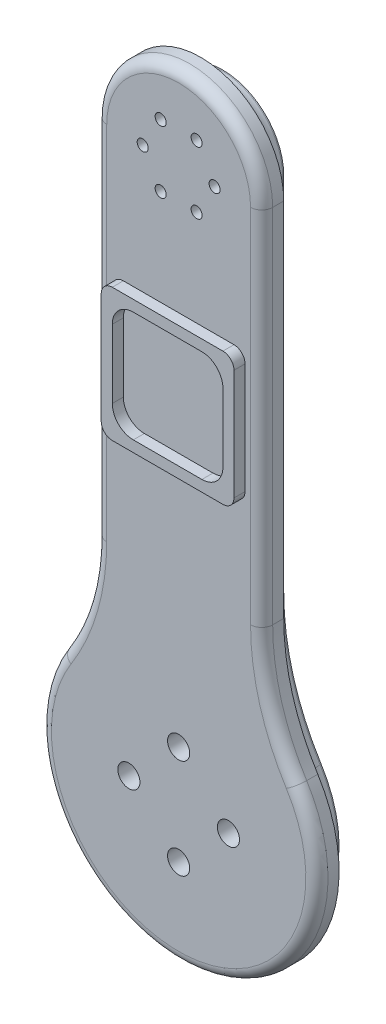
from build123d import *

# Parameters (mm, degrees)
BOSS_EXTRUDE1_DEPTH = 20
BOSS_EXTRUDE2_DEPTH = 20
FILLET1_R           = 19
FILLET2_R           = 10
SKETCH3_R           = 5
SKETCH3_R_2         = 10
CUT_EXTRUDE1_DEPTH  = 590.788097561
SKETCH4_W           = 120
SKETCH4_H           = 120
BOSS_EXTRUDE3_DEPTH = 10
FILLET3_R           = 10
CUT_EXTRUDE2_DEPTH  = 10


with BuildPart() as part:
    # Sketch1 → Boss-Extrude1 (new body)
    with BuildSketch(Plane.XY):
        with BuildLine():
            Line((-75, 500), (-75, 173.205080757))
            ThreePointArc((-75, 173.205080757), (-82.846215434, 117.735061134), (-105.769230769, 66.617338753))
            ThreePointArc((-105.769230769, 66.617338753), (0, -125), (105.769230769, 66.617338753))
            ThreePointArc((105.769230769, 66.617338753), (82.846215434, 117.735061134), (75, 173.205080757))
            Line((75, 173.205080757), (75, 500))
            ThreePointArc((75, 500), (0, 575), (-75, 500))
        make_face()
    extrude(amount=BOSS_EXTRUDE1_DEPTH)

    # Sketch2 → Boss-Extrude2 (add)
    with BuildSketch(Plane(origin=(0, 0, 0), x_dir=(-1, 0, 0), z_dir=(0, 0, -1))):
        with BuildLine():
            Line((-55, 500), (-55, 173.205080757))
            ThreePointArc((-55, 173.205080757), (-63.630836977, 112.188059172), (-88.846153846, 55.958564552))
            ThreePointArc((-88.846153846, 55.958564552), (0, -105), (88.846153846, 55.958564552))
            ThreePointArc((88.846153846, 55.958564552), (63.630836977, 112.188059172), (55, 173.205080757))
            Line((55, 173.205080757), (55, 500))
            ThreePointArc((55, 500), (0, 555), (-55, 500))
        make_face()
    extrude(amount=BOSS_EXTRUDE2_DEPTH)

    # Fillet1
    fillet1_edges = [part.edges().sort_by_distance(p)[0] for p in [
        (0, 555, 0),
        (55, 336.602540378, 0),
        (63.630836977, 112.188059172, 0),
        (0, -105, 0),
        (-63.630836977, 112.188059172, 0),
        (-55, 336.602540378, 0),
    ]]
    fillet(fillet1_edges, radius=FILLET1_R)

    # Fillet2
    fillet2_edges = [part.edges().sort_by_distance(p)[0] for p in [
        (-82.846215434, 117.735061134, 20),
        (0, -125, 20),
        (82.846215434, 117.735061134, 20),
        (75, 336.602540378, 20),
        (0, 575, 20),
        (-75, 336.602540378, 20),
    ]]
    fillet(fillet2_edges, radius=FILLET2_R)

    # Sketch3 → Cut-Extrude1 (cut, through all)
    with BuildSketch(Plane.XY.offset(20)):
        with Locations((-32.5, 500)):
            Circle(SKETCH3_R)
        with Locations((-16.25, 528.145825623)):
            Circle(SKETCH3_R)
        with Locations((16.25, 528.145825623)):
            Circle(SKETCH3_R)
        with Locations((32.5, 500)):
            Circle(SKETCH3_R)
        with Locations((16.25, 471.854174377)):
            Circle(SKETCH3_R)
        with Locations((-16.25, 471.854174377)):
            Circle(SKETCH3_R)
        with Locations((-45, 0)):
            Circle(SKETCH3_R_2)
        with Locations((0, 45)):
            Circle(SKETCH3_R_2)
        with Locations((45, 0)):
            Circle(SKETCH3_R_2)
        with Locations((0, -45)):
            Circle(SKETCH3_R_2)
    extrude(amount=-CUT_EXTRUDE1_DEPTH, mode=Mode.SUBTRACT)

    # Sketch4 → Boss-Extrude3 (add)
    with BuildSketch(Plane.XY.offset(20)):
        with Locations((0, 325)):
            Rectangle(SKETCH4_W, SKETCH4_H)
    extrude(amount=BOSS_EXTRUDE3_DEPTH)

    # Fillet3
    fillet3_edges = [part.edges().sort_by_distance(p)[0] for p in [
        (60, 265, 25),
        (60, 385, 25),
        (-60, 385, 25),
        (-60, 265, 25),
    ]]
    fillet(fillet3_edges, radius=FILLET3_R)

    # Sketch5 → Cut-Extrude2 (cut)
    with BuildSketch(Plane.XY.offset(30)):
        with BuildLine():
            Line((31, 275), (-31, 275))
            ThreePointArc((-31, 275), (-44.435028843, 280.564971157), (-50, 294))
            Line((-50, 294), (-50, 356))
            ThreePointArc((-50, 356), (-44.435028843, 369.435028843), (-31, 375))
            Line((-31, 375), (31, 375))
            ThreePointArc((31, 375), (44.435028843, 369.435028843), (50, 356))
            Line((50, 356), (50, 294))
            ThreePointArc((50, 294), (44.435028843, 280.564971157), (31, 275))
        make_face()
    extrude(amount=-CUT_EXTRUDE2_DEPTH, mode=Mode.SUBTRACT)


solid = part.part
